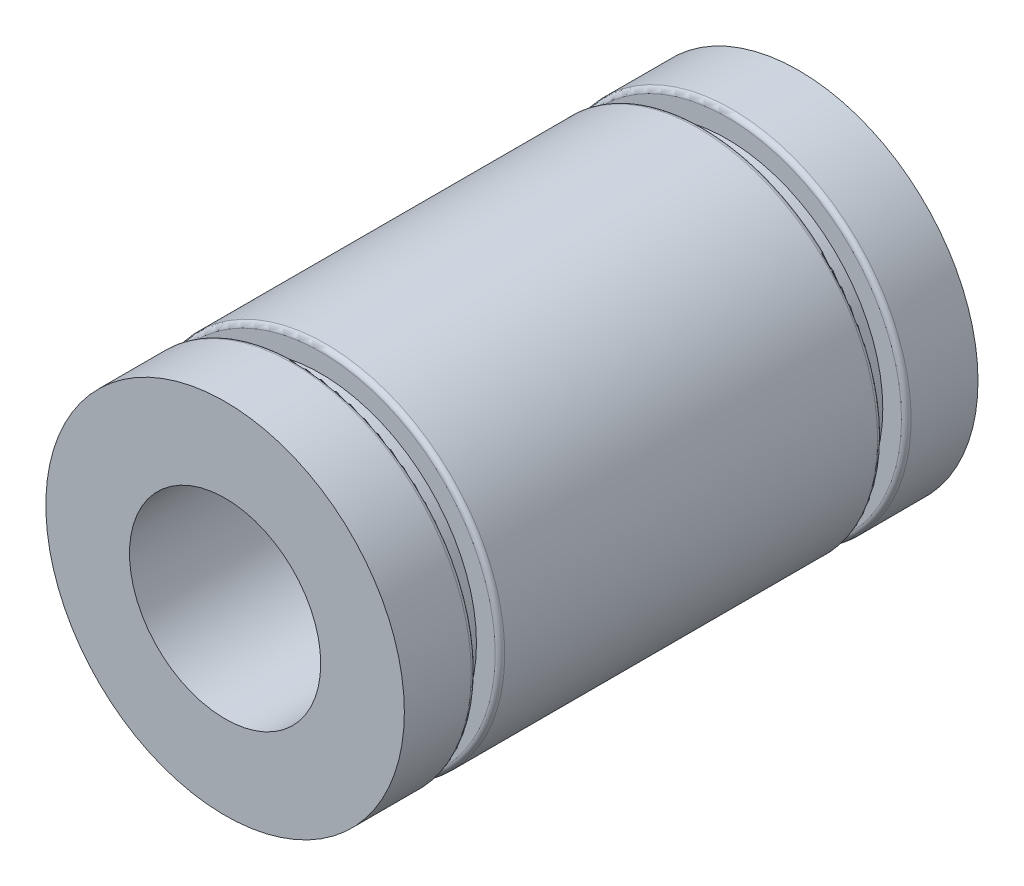
from build123d import *

# Parameters (mm, degrees)
SKETCH_1_R      = 7.5
SKETCH_1_R_2    = 4
EXTRUDE_1_DEPTH = 24
SKETCH_4_W      = 1
SKETCH_4_H      = 1
FILLET_1_R      = 0.2


with BuildPart() as part:
    # 草图1 → 凸台-拉伸1 (new body)
    with BuildSketch(Plane.XY):
        Circle(SKETCH_1_R)
        Circle(SKETCH_1_R_2, mode=Mode.SUBTRACT)
    extrude(amount=EXTRUDE_1_DEPTH)

    # 草图4 → 切除-旋转1 (revolve, cut)
    with BuildSketch(Plane(origin=(0, 0, 0), x_dir=(0, 0, -1), z_dir=(1, 0, 0)), mode=Mode.PRIVATE) as cut_revolve_1_sk:
        with Locations((-20.5, 7.016772844)):
            Rectangle(SKETCH_4_W, SKETCH_4_H)
        with Locations((-3.5, 7.016772844)):
            Rectangle(SKETCH_4_W, SKETCH_4_H)
    revolve(cut_revolve_1_sk.sketch.rotate(Axis((0, 0, 0), (0, 0, 1)), 90), axis=Axis((0, 0, 0), (0, 0, 1)), mode=Mode.SUBTRACT)

    # 圆角1
    fillet_1_edges = [part.edges().sort_by_distance(p)[0] for p in [
        (-7.5, 0, 21),
        (-7.5, 0, 20),
        (-7.5, 0, 4),
        (-7.5, 0, 3),
    ]]
    fillet(fillet_1_edges, radius=FILLET_1_R)


solid = part.part
